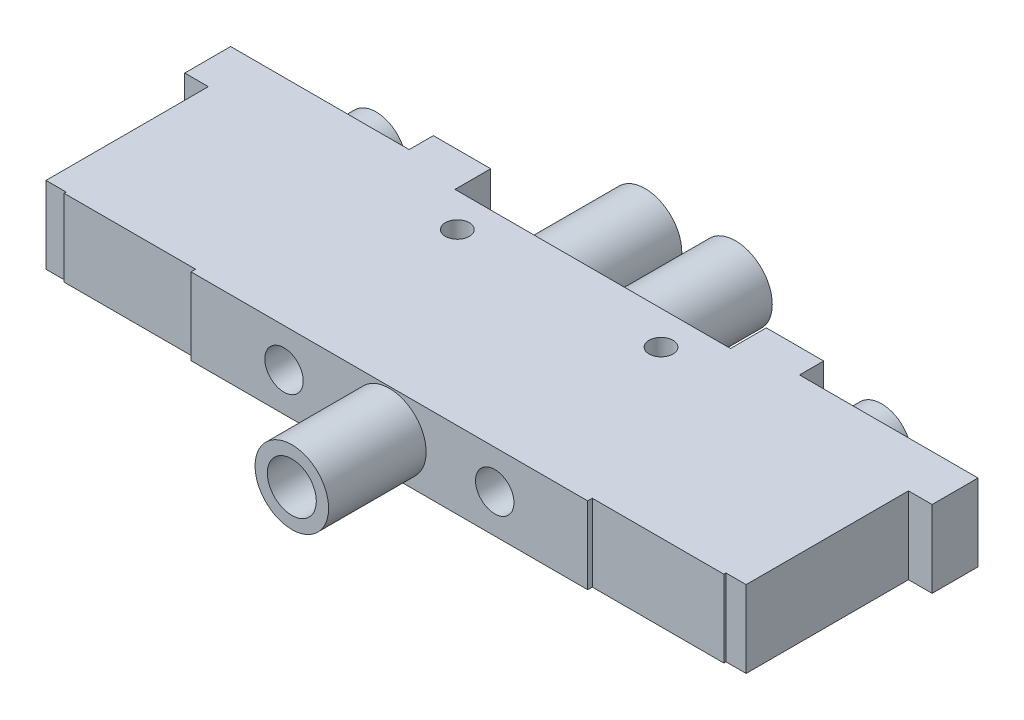
from build123d import *

# Parameters (mm, degrees)
SKETCH1_R                       = 1.5875
BOSS_EXTRUDE1_DEPTH             = 10.2235
SKETCH2_R                       = 4.88315
SKETCH2_R_2                     = 3.2512
BOSS_EXTRUDE2_DEPTH             = 12.954
SKETCH3_R                       = 4.88315
SKETCH3_R_2                     = 3.2512
BOSS_EXTRUDE3_DEPTH             = 12.954
TAP_DRILL_FOR_1_4_20_TAP1_D     = 5.1054
TAP_DRILL_FOR_1_4_20_TAP1_DEPTH = 9.0551
TAP_DRILL_FOR_1_4_20_TAP1_TIP   = 1.533816902
SKETCH6_R                       = 4.0005
BOSS_EXTRUDE4_DEPTH             = 3.2512


with BuildPart() as part:
    # Sketch1 → Boss-Extrude1 (new body)
    with BuildSketch(Plane(origin=(0, 0, 0), x_dir=(1, 0, 0), z_dir=(0, 1, 0))):
        Polygon((-18.3007, 0), (18.3007, 0), (18.3007, 4.7498), (25.9207, 4.7498), (25.9207, 1.5367), (49.6316, 1.5367), (49.6316, -4.5593), (46.4947, -4.5593), (46.4947, -26.1239), (43.815, -26.1239), (43.815, -26.4033), (26.3398, -26.4033), (26.3398, -27.0129), (-26.3398, -27.0129), (-26.3398, -26.4033), (-43.815, -26.4033), (-43.815, -26.1239), (-46.4947, -26.1239), (-46.4947, -4.5593), (-49.6316, -4.5593), (-49.6316, 1.5367), (-25.9207, 1.5367), (-25.9207, 4.7498), (-18.3007, 4.7498), align=None)
        with Locations(Location((13.5255, -4.4577, 0), (0, 0, 270))):
            Circle(SKETCH1_R, mode=Mode.SUBTRACT)
        with Locations(Location((-13.5255, -4.4577, 0), (0, 0, 90))):
            Circle(SKETCH1_R, mode=Mode.SUBTRACT)
    extrude(amount=BOSS_EXTRUDE1_DEPTH)

    # Sketch2 → Boss-Extrude2 (add)
    with BuildSketch(Plane.XY.offset(27.0129)):
        with Locations(Location((0, 5.11175, 0), (0, 0, 180))):
            Circle(SKETCH2_R)
        with Locations((0, 5.11175)):
            Circle(SKETCH2_R_2, mode=Mode.SUBTRACT)
    extrude(amount=BOSS_EXTRUDE2_DEPTH)

    # Sketch3 → Boss-Extrude3 (add)
    # profile 1 of 2: a face of its own
    with BuildSketch(Plane(origin=(0, 0, 0), x_dir=(-1, 0, 0), z_dir=(0, 0, -1))):
        with Locations(Location((6.0071, 5.11175, 0), (0, 0, 180))):
            Circle(SKETCH3_R)
        with Locations((6.0071, 5.11175)):
            Circle(SKETCH3_R_2, mode=Mode.SUBTRACT)
    # profile 2 of 2: a face of its own
    with BuildSketch(Plane(origin=(0, 0, 0), x_dir=(-1, 0, 0), z_dir=(0, 0, -1))):
        with Locations(Location((-6.0071, 5.11175, 0), (0, 0, 180))):
            Circle(SKETCH3_R)
        with Locations((-6.0071, 5.11175)):
            Circle(SKETCH3_R_2, mode=Mode.SUBTRACT)
    extrude(amount=BOSS_EXTRUDE3_DEPTH)

    # Tap Drill for 1/4-20 Tap1
    with Locations(Plane.XY.offset(27.0129)):
        with Locations((-13.9954, 5.11175), (13.9954, 5.11175)):
            Hole(TAP_DRILL_FOR_1_4_20_TAP1_D / 2, depth=TAP_DRILL_FOR_1_4_20_TAP1_DEPTH)
            with Locations((0, 0, -(TAP_DRILL_FOR_1_4_20_TAP1_DEPTH + TAP_DRILL_FOR_1_4_20_TAP1_TIP / 2))):  # 118° drill point
                Cone(0, TAP_DRILL_FOR_1_4_20_TAP1_D / 2, TAP_DRILL_FOR_1_4_20_TAP1_TIP, mode=Mode.SUBTRACT)

    # Sketch6 → Boss-Extrude4 (add)
    with BuildSketch(Plane(origin=(0, 0, -1.5367), x_dir=(-1, 0, 0), z_dir=(0, 0, -1))):
        with Locations(Location((-33.5661, 5.11175, 0), (0, 0, 180))):
            Circle(SKETCH6_R)
        with Locations(Location((33.5661, 5.11175, 0), (0, 0, 180))):
            Circle(SKETCH6_R)
    extrude(amount=BOSS_EXTRUDE4_DEPTH)


solid = part.part
